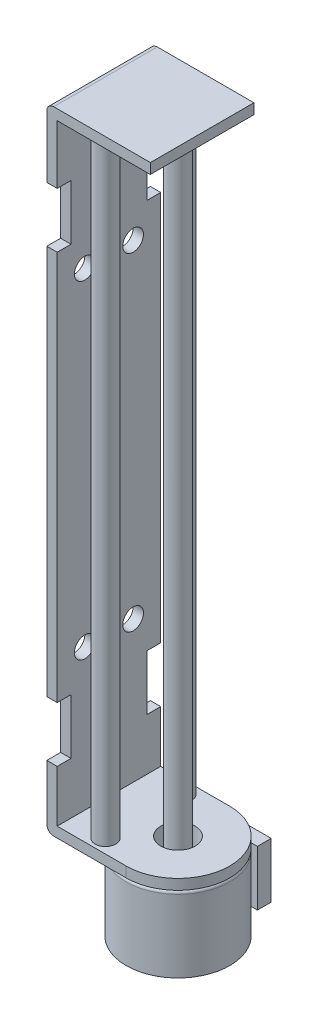
from build123d import *

# Parameters (mm, degrees)
SKETCH1_R           = 7.5
BOSS_EXTRUDE1_DEPTH = 11
FILLET1_R           = 0.5
BOSS_EXTRUDE2_DEPTH = 1.5
SKETCH5_W           = 1.5
SKETCH5_H           = 15
BOSS_EXTRUDE3_DEPTH = 90
FILLET2_R           = 1
SKETCH7_W           = 15
SKETCH7_H           = 1.5
BOSS_EXTRUDE4_DEPTH = 15
FILLET3_R           = 1
SKETCH8_R           = 2.5
CUT_EXTRUDE1_DEPTH  = 10
SKETCH9_R           = 1.5
BOSS_EXTRUDE5_DEPTH = 90
SKETCH10_R          = 1.5
BOSS_EXTRUDE6_DEPTH = 99
SKETCH11_R          = 1.5
CUT_EXTRUDE2_DEPTH  = 2
SKETCH12_W          = 2
SKETCH12_H          = 8
CUT_EXTRUDE3_DEPTH  = 2
SKETCH13_W          = 8
SKETCH13_H          = 8
BOSS_EXTRUDE7_DEPTH = 2


with BuildPart() as part:
    # Sketch1 → Boss-Extrude1 (new body)
    with BuildSketch(Plane(origin=(0, 0, 0), x_dir=(1, 0, 0), z_dir=(0, 1, 0))):
        with Locations(Location((0, 0, 0), (0, 0, 270))):
            Circle(SKETCH1_R)
    extrude(amount=BOSS_EXTRUDE1_DEPTH)

    # Fillet1
    fillet1_edges = [part.edges().sort_by_distance(p)[0] for p in [
        (0, 11, -7.5),
    ]]
    fillet(fillet1_edges, radius=FILLET1_R)

    # Sketch3 → Boss-Extrude2 (add)
    with BuildSketch(Plane(origin=(0, 11, 0), x_dir=(1, 0, 0), z_dir=(0, 1, 0))):
        with BuildLine():
            Line((0, -7.5), (-10, -7.5))
            Line((-10, -7.5), (-10, 7.5))
            Line((-10, 7.5), (0, 7.5))
            ThreePointArc((0, 7.5), (7.5, 0), (0, -7.5))
        make_face()
    extrude(amount=BOSS_EXTRUDE2_DEPTH)

    # Sketch5 → Boss-Extrude3 (add)
    with BuildSketch(Plane.XZ.offset(-11)):
        with Locations((-10.75, 0)):
            Rectangle(SKETCH5_W, SKETCH5_H)
    extrude(amount=-BOSS_EXTRUDE3_DEPTH)

    # Fillet2
    fillet2_edges = [part.edges().sort_by_distance(p)[0] for p in [
        (-11.5, 11, 0),
    ]]
    fillet(fillet2_edges, radius=FILLET2_R)

    # Sketch7 → Boss-Extrude4 (add)
    with BuildSketch(Plane.ZY.offset(11.5)):
        with Locations((0, 101.75)):
            Rectangle(SKETCH7_W, SKETCH7_H)
    extrude(amount=-BOSS_EXTRUDE4_DEPTH)

    # Fillet3
    fillet3_edges = [part.edges().sort_by_distance(p)[0] for p in [
        (-11.5, 102.5, 0),
    ]]
    fillet(fillet3_edges, radius=FILLET3_R)

    # Sketch8 → Cut-Extrude1 (cut)
    with BuildSketch(Plane(origin=(0, 12.5, 0), x_dir=(1, 0, 0), z_dir=(0, 1, 0))):
        with Locations(Location((0, 0, 0), (0, 0, 270))):
            Circle(SKETCH8_R)
    extrude(amount=-CUT_EXTRUDE1_DEPTH, mode=Mode.SUBTRACT)

    # Sketch9 → Boss-Extrude5 (add)
    with BuildSketch(Plane(origin=(0, 12.5, 0), x_dir=(1, 0, 0), z_dir=(0, 1, 0))):
        with Locations(Location((-5, 5.5, 0), (0, 0, 90))):
            Circle(SKETCH9_R)
        with Locations(Location((-5, -5.5, 0), (0, 0, 90))):
            Circle(SKETCH9_R)
    extrude(amount=BOSS_EXTRUDE5_DEPTH)

    # Sketch10 → Boss-Extrude6 (add)
    with BuildSketch(Plane(origin=(0, 2.5, 0), x_dir=(1, 0, 0), z_dir=(0, 1, 0))):
        with Locations(Location((0, 0, 0), (0, 0, 90))):
            Circle(SKETCH10_R)
    extrude(amount=BOSS_EXTRUDE6_DEPTH)

    # Sketch11 → Cut-Extrude2 (cut)
    with BuildSketch(Plane.ZY.offset(11.5)):
        with Locations((-3.5, 80.5)):
            Circle(SKETCH11_R)
        with Locations((3.5, 80.5)):
            Circle(SKETCH11_R)
        with Locations((-3.5, 33)):
            Circle(SKETCH11_R)
        with Locations((3.5, 33)):
            Circle(SKETCH11_R)
    extrude(amount=-CUT_EXTRUDE2_DEPTH, mode=Mode.SUBTRACT)

    # Sketch12 → Cut-Extrude3 (cut)
    with BuildSketch(Plane.ZY.offset(11.5)):
        with Locations((6.5, 24)):
            Rectangle(SKETCH12_W, SKETCH12_H)
        with Locations((-6.5, 24)):
            Rectangle(SKETCH12_W, SKETCH12_H)
        with Locations((6.5, 88.5)):
            Rectangle(SKETCH12_W, SKETCH12_H)
        with Locations((-6.5, 88.5)):
            Rectangle(SKETCH12_W, SKETCH12_H)
    extrude(amount=-CUT_EXTRUDE3_DEPTH, mode=Mode.SUBTRACT)


with BuildPart() as body_2:
    # Sketch13 → Boss-Extrude7 (new body)
    with BuildSketch(Plane.XY.offset(-7.5)):
        with Locations((0, 5.467961161)):
            Rectangle(SKETCH13_W, SKETCH13_H)
    extrude(amount=-BOSS_EXTRUDE7_DEPTH)


solid = Compound([part.part, body_2.part])
